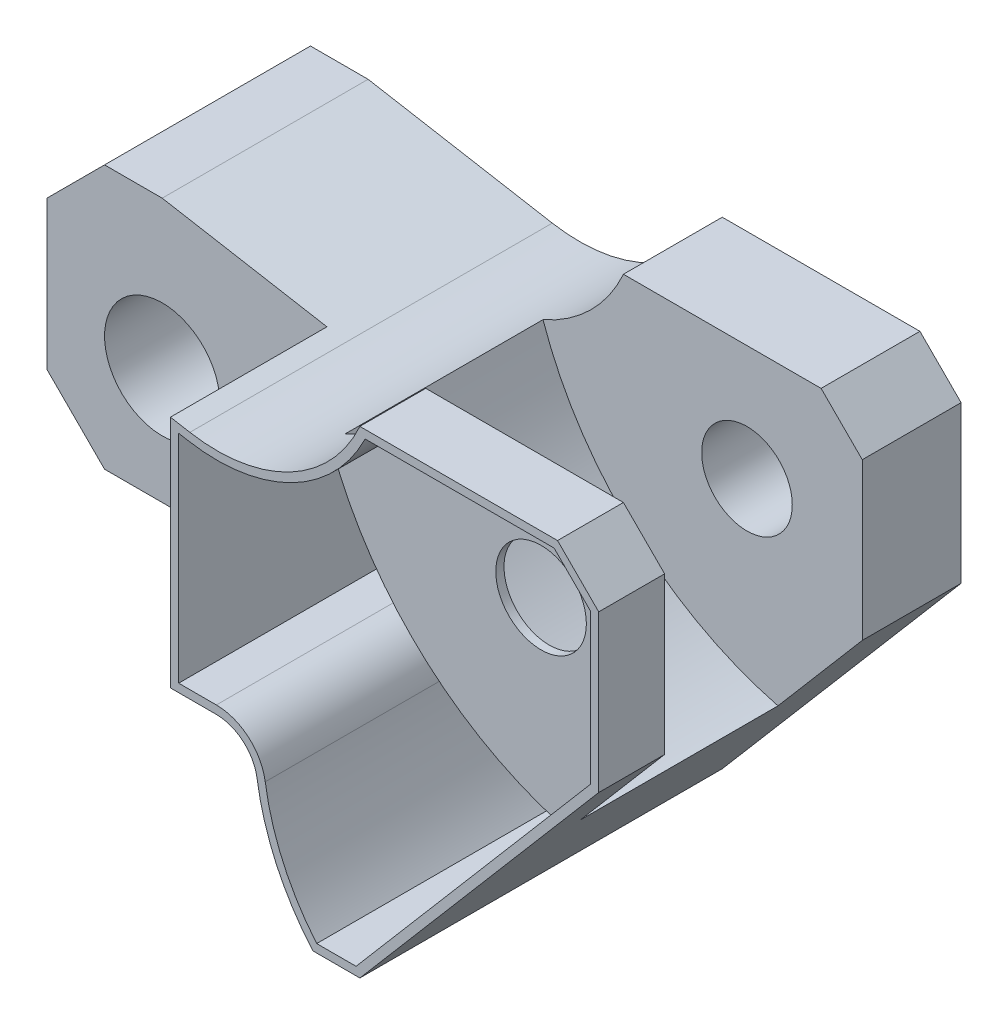
from build123d import *

# Parameters (mm, degrees)
SKETCH1_R           = 7
BOSS_EXTRUDE1_DEPTH = 22
CUT_EXTRUDE1_START  = 14
CUT_EXTRUDE1_DEPTH  = 24
CUT_EXTRUDE2_START  = -19
SKETCH5_R           = 7
CUT_EXTRUDE2_DEPTH  = 19
SKETCH6_R           = 5.5
CUT_EXTRUDE3_DEPTH  = 91.60353194
CUT_EXTRUDE4_DEPTH  = 7
CUT_EXTRUDE5_DEPTH  = 25


with BuildPart() as part:
    # Sketch1 → Boss-Extrude1 (new, symmetric)
    with BuildSketch(Plane.XY):
        with BuildLine():
            Line((-14, 11), (-14, -7))
            Line((-14, -7), (-7, -14))
            Line((-7, -14), (25.575538911, -14))
            ThreePointArc((25.575538911, -14), (28.840774692, -15.213413768), (30.521177653, -18.264705882))
            ThreePointArc((30.521177653, -18.264705882), (32.858007856, -26.115672061), (37.296980053, -33))
            Line((37.296980053, -33), (43, -33))
            Line((43, -33), (72, 1))
            Line((72, 1), (72, 20))
            Line((72, 20), (67, 25))
            Line((67, 25), (43, 25))
            ThreePointArc((43, 25), (34.561098706, 15.982044142), (22.361380836, 14.057085233))
            Line((22.361380836, 14.057085233), (0, 18))
            Line((0, 18), (-7, 18))
            Line((-7, 18), (-14, 11))
        make_face()
        Circle(SKETCH1_R, mode=Mode.SUBTRACT)
    extrude(amount=BOSS_EXTRUDE1_DEPTH, both=True)

    # Sketch3 → Cut-Extrude1 (cut)
    with BuildSketch(Plane.XY.offset(CUT_EXTRUDE1_START)):
        with BuildLine():
            Line((72, 1), (72, 20))
            Line((72, 20), (67, 25))
            Line((67, 25), (43, 25))
            ThreePointArc((43, 25), (39.021244343, 19.259333621), (33.236936549, 15.344294617))
            ThreePointArc((33.236936549, 15.344294617), (44.184262982, -1.419294771), (61.764705882, -11))
            Line((61.764705882, -11), (72, 1))
        make_face()
    extrude(amount=-CUT_EXTRUDE1_DEPTH, mode=Mode.SUBTRACT)

    # Sketch5 → Cut-Extrude2 (cut)
    with BuildSketch(Plane.XY.offset(22).offset(CUT_EXTRUDE2_START)):
        Polygon((20, -14), (20, 14.473460386), (0, 18), (-7, 18), (-14, 11), (-14, -7), (-7, -14), align=None)
        Circle(SKETCH5_R, mode=Mode.SUBTRACT)
    extrude(amount=CUT_EXTRUDE2_DEPTH, mode=Mode.SUBTRACT)

    # Sketch6 → Cut-Extrude3 (cut, through all)
    with BuildSketch(Plane.XY.offset(22)):
        with Locations((58, 11)):
            Circle(SKETCH6_R)
    extrude(amount=-CUT_EXTRUDE3_DEPTH, mode=Mode.SUBTRACT)

    # Sketch7 → Cut-Extrude4 (cut)
    with BuildSketch(Plane.XY.offset(22)):
        with BuildLine():
            Line((22.187732658, 13.07227748), (21, 13.281706793))
            Line((21, 13.281706793), (21, -13))
            Line((21, -13), (25.575538911, -13))
            ThreePointArc((25.575538911, -13), (29.493821849, -14.456096521), (31.510305401, -18.117647059))
            ThreePointArc((31.510305401, -18.117647059), (33.672704892, -25.491599052), (37.758271763, -32))
            Line((37.758271763, -32), (42.538593943, -32))
            Line((42.538593943, -32), (71, 1.368545033))
            Line((71, 1.368545033), (71, 19.585786438))
            Line((71, 19.585786438), (66.585786438, 24))
            Line((66.585786438, 24), (43.636084685, 24))
            ThreePointArc((43.636084685, 24), (34.740005768, 14.948047079), (22.187732658, 13.07227748))
        make_face()
    extrude(amount=-CUT_EXTRUDE4_DEPTH, mode=Mode.SUBTRACT)

    # Sketch8 → Cut-Extrude5 (cut)
    with BuildSketch(Plane.XY.offset(15)):
        with BuildLine():
            Line((42.538593943, -32), (59.986847747, -11.543426575))
            ThreePointArc((59.986847747, -11.543426575), (43.310181683, -1.972127362), (32.646682943, 14.028208705))
            ThreePointArc((32.646682943, 14.028208705), (27.481076416, 12.851449437), (22.187732658, 13.07227748))
            Line((22.187732658, 13.07227748), (21, 13.281706793))
            Line((21, 13.281706793), (21, -13))
            Line((21, -13), (25.575538911, -13))
            ThreePointArc((25.575538911, -13), (29.493821849, -14.456096521), (31.510305401, -18.117647059))
            ThreePointArc((31.510305401, -18.117647059), (33.672704892, -25.491599052), (37.758271763, -32))
            Line((37.758271763, -32), (42.538593943, -32))
        make_face()
    extrude(amount=-CUT_EXTRUDE5_DEPTH, mode=Mode.SUBTRACT)


solid = part.part
